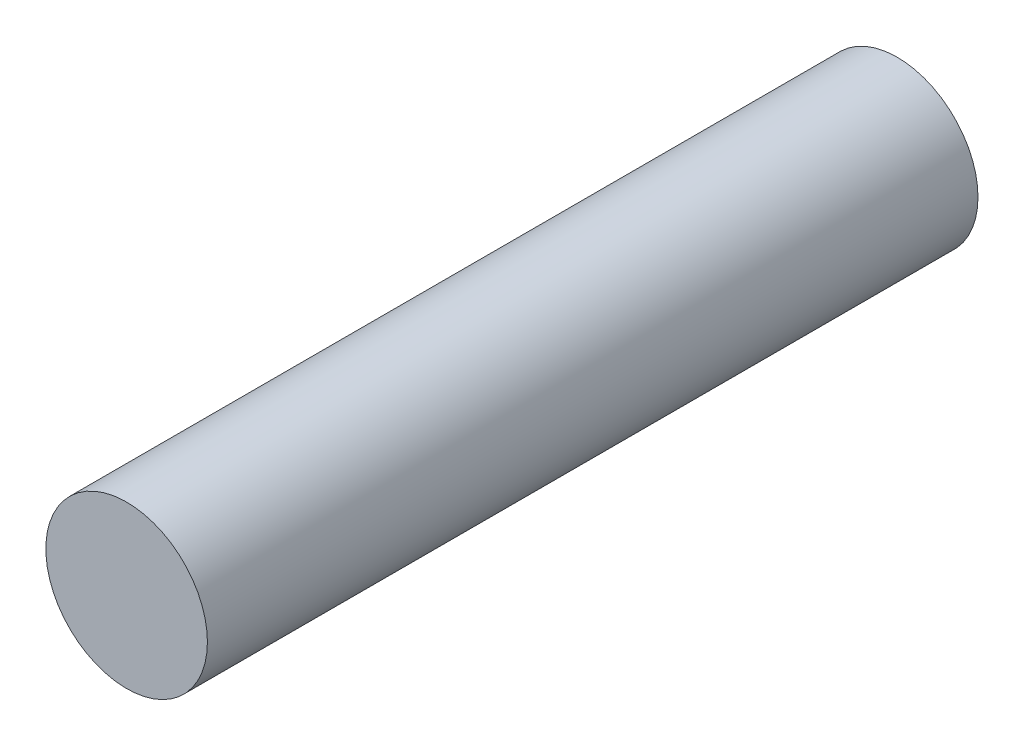
from build123d import *

# Parameters (mm, degrees)
SKETCH_1_R      = 3.25
EXTRUDE_1_DEPTH = 31


with BuildPart() as part:
    # Эскиз1 → Бобышка-Вытянуть1 (new body)
    with BuildSketch(Plane.XY):
        Circle(SKETCH_1_R)
    extrude(amount=EXTRUDE_1_DEPTH)


solid = part.part
